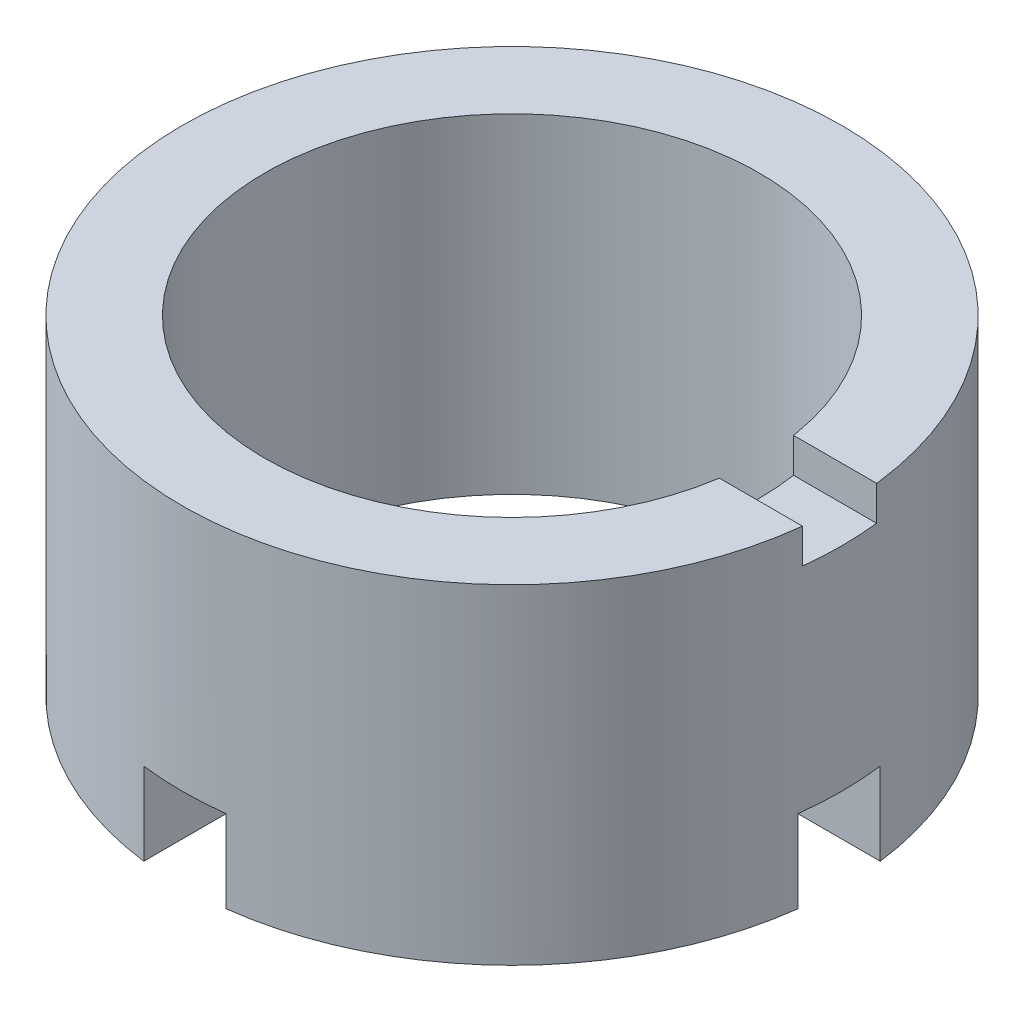
from build123d import *

# Parameters (mm, degrees)
SKETCH1_R           = 25.4
SKETCH1_R_2         = 19.05
BOSS_EXTRUDE1_DEPTH = 25.4
SKETCH2_W           = 15.24
SKETCH2_H           = 6.35
SKETCH2_W_2         = 6.35
SKETCH2_H_2         = 15.24
CUT_EXTRUDE1_DEPTH  = 6.35
SKETCH3_W           = 19.80573375
SKETCH3_H           = 5.715
CUT_EXTRUDE2_DEPTH  = 2.667


with BuildPart() as part:
    # Sketch1 → Boss-Extrude1 (new body)
    with BuildSketch(Plane(origin=(0, 0, 0), x_dir=(1, 0, 0), z_dir=(0, 1, 0))):
        with Locations(Location((0, 0, 0), (0, 0, 270))):
            Circle(SKETCH1_R)
        with Locations(Location((0, 0, 0), (0, 0, 270))):
            Circle(SKETCH1_R_2, mode=Mode.SUBTRACT)
    extrude(amount=BOSS_EXTRUDE1_DEPTH)

    # Sketch2 → Cut-Extrude1 (cut)
    with BuildSketch(Plane.XZ):
        with Locations((25.4, 0)):
            Rectangle(SKETCH2_W, SKETCH2_H)
        with Locations((0, 25.4)):
            Rectangle(SKETCH2_W_2, SKETCH2_H_2)
    extrude(amount=-CUT_EXTRUDE1_DEPTH, mode=Mode.SUBTRACT)

    # Sketch3 → Cut-Extrude2 (cut)
    with BuildSketch(Plane(origin=(0, 25.4, 0), x_dir=(1, 0, 0), z_dir=(0, 1, 0))):
        with Locations((25.4, 0)):
            Rectangle(SKETCH3_W, SKETCH3_H)
    extrude(amount=-CUT_EXTRUDE2_DEPTH, mode=Mode.SUBTRACT)


solid = part.part
